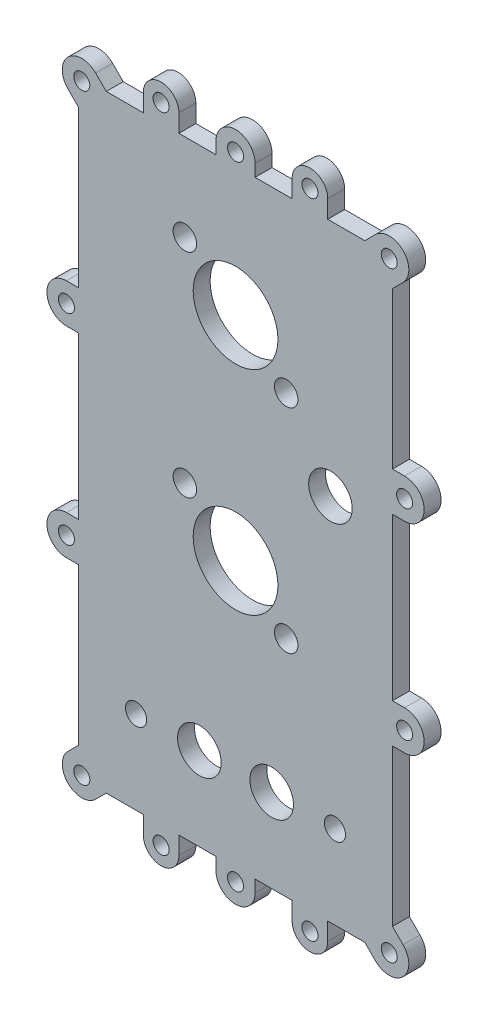
from build123d import *

# Parameters (mm, degrees)
BOSS_EXTRUDE1_DEPTH  = 4.7625
M4_CLEARANCE_HOLE1_D = 4.5
SKETCH4_R            = 3.3
SKETCH4_R_2          = 2.9765625
SKETCH4_R_3          = 6.125
SKETCH4_R_4          = 11.9
CUT_EXTRUDE1_DEPTH   = 4.7625
BOSS_EXTRUDE3_DEPTH  = 4.7625
M4_CLEARANCE_HOLE2_D = 4.5


with BuildPart() as part:
    # Sketch1 → Boss-Extrude1 (new body)
    with BuildSketch(Plane.XY):
        with BuildLine():
            Line((50.349976536, 7.779015878), (19.528151129, 7.779015878))
            Line((19.528151129, 7.779015878), (16.547693582, 10.759473425))
            ThreePointArc((16.547693582, 10.759473425), (8.769518989, 10.759473425), (8.769518989, 2.981298831))
            Line((8.769518989, 2.981298831), (11.749976536, 0.000841285))
            Line((11.749976536, 0.000841285), (11.749976536, -43.901984122))
            Line((11.749976536, -43.901984122), (8.340276536, -43.901984122))
            ThreePointArc((8.340276536, -43.901984122), (2.840276536, -49.401984122), (8.340276536, -54.901984122))
            Line((8.340276536, -54.901984122), (11.749976536, -54.901984122))
            Line((11.749976536, -54.901984122), (11.749976536, -100.289984122))
            Line((11.749976536, -100.289984122), (8.340276536, -100.289984122))
            ThreePointArc((8.340276536, -100.289984122), (2.840276536, -105.789984122), (8.340276536, -111.289984122))
            Line((8.340276536, -111.289984122), (11.749976536, -111.289984122))
            Line((11.749976536, -111.289984122), (11.749976536, -155.192809529))
            Line((11.749976536, -155.192809529), (8.769518989, -158.173267075))
            ThreePointArc((8.769518989, -158.173267075), (8.769518989, -165.951441668), (16.547693582, -165.951441668))
            Line((16.547693582, -165.951441668), (19.528151129, -162.970984122))
            Line((19.528151129, -162.970984122), (50.349976536, -162.970984122))
            Line((50.349976536, -162.970984122), (50.349976536, -166.380684122))
            ThreePointArc((50.349976536, -166.380684122), (55.849976536, -171.880684122), (61.349976536, -166.380684122))
            Line((61.349976536, -166.380684122), (61.349976536, -162.970984122))
            Line((61.349976536, -162.970984122), (92.171801943, -162.970984122))
            Line((92.171801943, -162.970984122), (95.152259489, -165.951441668))
            ThreePointArc((95.152259489, -165.951441668), (102.930434082, -165.951441668), (102.930434082, -158.173267075))
            Line((102.930434082, -158.173267075), (99.949976536, -155.192809529))
            Line((99.949976536, -155.192809529), (99.949976536, -111.289984122))
            Line((99.949976536, -111.289984122), (103.359676536, -111.289984122))
            ThreePointArc((103.359676536, -111.289984122), (108.859676536, -105.789984122), (103.359676536, -100.289984122))
            Line((103.359676536, -100.289984122), (99.949976536, -100.289984122))
            Line((99.949976536, -100.289984122), (99.949976536, -54.901984122))
            Line((99.949976536, -54.901984122), (103.359676536, -54.901984122))
            ThreePointArc((103.359676536, -54.901984122), (108.859676536, -49.401984122), (103.359676536, -43.901984122))
            Line((103.359676536, -43.901984122), (99.949976536, -43.901984122))
            Line((99.949976536, -43.901984122), (99.949976536, 0.000841285))
            Line((99.949976536, 0.000841285), (102.930434082, 2.981298831))
            ThreePointArc((102.930434082, 2.981298831), (102.930434082, 10.759473425), (95.152259489, 10.759473425))
            Line((95.152259489, 10.759473425), (92.171801943, 7.779015878))
            Line((92.171801943, 7.779015878), (61.349976536, 7.779015878))
            Line((61.349976536, 7.779015878), (61.349976536, 11.188715878))
            ThreePointArc((61.349976536, 11.188715878), (55.849976536, 16.688715878), (50.349976536, 11.188715878))
            Line((50.349976536, 11.188715878), (50.349976536, 7.779015878))
        make_face()
    extrude(amount=-BOSS_EXTRUDE1_DEPTH)

    # M4 Clearance Hole1 (through all)
    with Locations(Plane(origin=(0, 0, -4.7625), x_dir=(-1, 0, 0), z_dir=(0, 0, -1))):
        with Locations((-12.658606286, -162.062354372), (-55.849976536, -166.380684122), (-99.041346785, -162.062354372), (-103.359676536, -105.789984122), (-103.359676536, -49.401984122), (-99.041346785, 6.870386128), (-12.658606286, 6.870386128), (-8.340276536, -49.401984122), (-8.340276536, -105.789984122), (-55.849976536, 11.188715878)):
            Hole(M4_CLEARANCE_HOLE1_D / 2)

    # Sketch4 → Cut-Extrude1 (cut)
    with BuildSketch(Plane(origin=(0, 0, -4.7625), x_dir=(-1, 0, 0), z_dir=(0, 0, -1))):
        with Locations((-41.616084767, -16.665859852)):
            Circle(SKETCH4_R)
        with Locations((-70.083868304, -40.3002691)):
            Circle(SKETCH4_R)
        with Locations((-27.909976536, -139.508484122)):
            Circle(SKETCH4_R_2)
        with Locations((-41.616084767, -76.466699143)):
            Circle(SKETCH4_R)
        with Locations((-83.789976536, -139.508484122)):
            Circle(SKETCH4_R_2)
        with Locations((-70.083868304, -100.101108391)):
            Circle(SKETCH4_R)
        with Locations((-66.009976536, -139.508484122)):
            Circle(SKETCH4_R_3)
        with Locations((-82.519976536, -59.220984122)):
            Circle(SKETCH4_R_3)
        with Locations((-45.689976536, -139.508484122)):
            Circle(SKETCH4_R_3)
        with Locations((-55.849976536, -88.283903767)):
            Circle(SKETCH4_R_4)
        with Locations((-55.849976536, -28.483064476)):
            Circle(SKETCH4_R_4)
    extrude(amount=-CUT_EXTRUDE1_DEPTH, mode=Mode.SUBTRACT)

    # Sketch6 → Boss-Extrude3 (add)
    with BuildSketch(Plane.XY):
        with BuildLine():
            ThreePointArc((39.939063832, 12.779015878), (34.939063832, 17.779015878), (29.939063832, 12.779015878))
            Line((29.939063832, 12.779015878), (29.939063832, 7.779015878))
            Line((29.939063832, 7.779015878), (39.939063832, 7.779015878))
            Line((39.939063832, 7.779015878), (39.939063832, 12.779015878))
        make_face()
        with BuildLine():
            Line((81.760889239, -162.970984122), (71.760889239, -162.970984122))
            Line((71.760889239, -162.970984122), (71.760889239, -167.970984122))
            ThreePointArc((71.760889239, -167.970984122), (76.760889239, -172.970984122), (81.760889239, -167.970984122))
            Line((81.760889239, -167.970984122), (81.760889239, -162.970984122))
        make_face()
    boss_extrude3 = extrude(amount=-BOSS_EXTRUDE3_DEPTH)

    # M4 Clearance Hole2 (through all)
    with Locations(Plane.XY):
        with Locations((34.939063832, 12.779015878), (76.760889239, -167.970984122)):
            m4_clearance_hole2 = Hole(M4_CLEARANCE_HOLE2_D / 2)

    # Mirror1: Boss-Extrude3, M4 Clearance Hole2 across plane
    add(boss_extrude3.mirror(Plane.ZY.offset(-55.849976536)))
    add(m4_clearance_hole2.mirror(Plane.ZY.offset(-55.849976536)), mode=Mode.SUBTRACT)


solid = part.part
